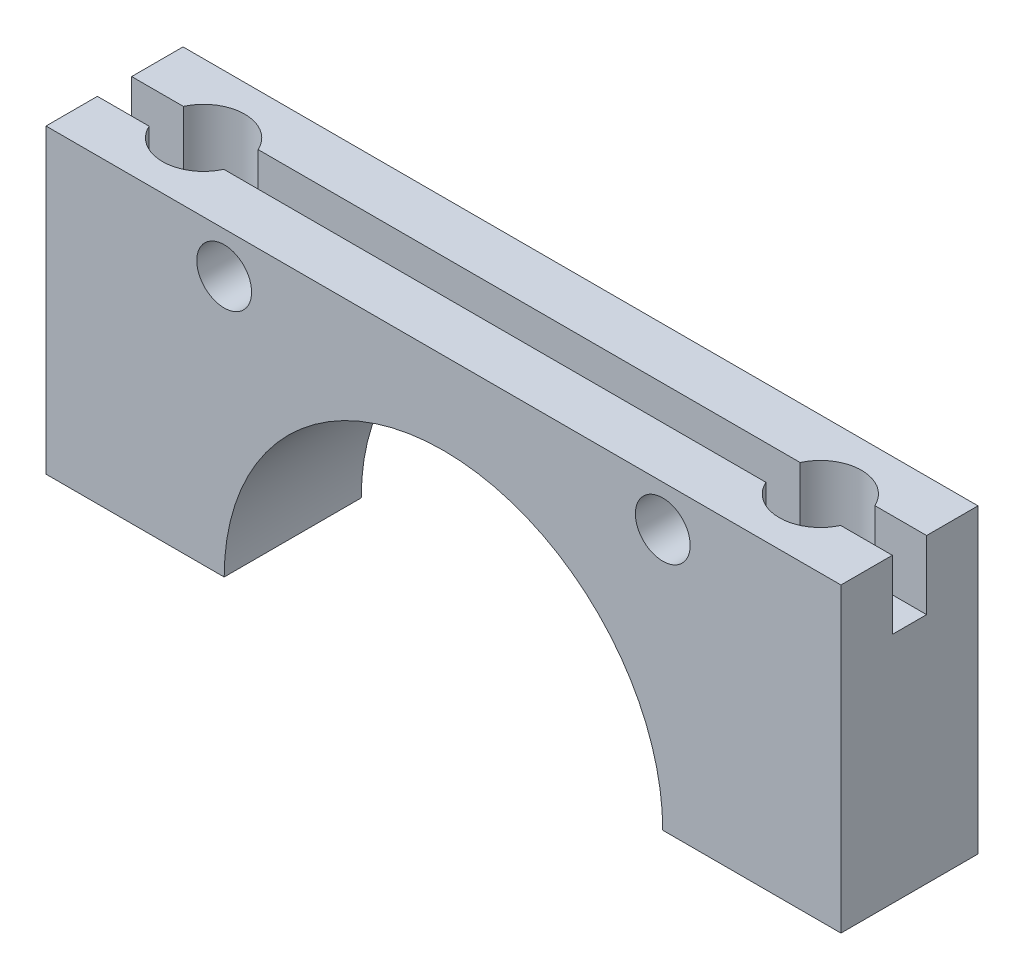
from build123d import *

# Parameters (mm, degrees)
EXTRUDE_1_DEPTH     = 10
SKETCH_2_R          = 1.6
CUT_EXTRUDE_1_DEPTH = 27
SKETCH_3_R          = 3
CUT_EXTRUDE_2_DEPTH = 15
SKETCH_4_W          = 58
SKETCH_4_H          = 2.5
CUT_EXTRUDE_4_DEPTH = 5
SKETCH_5_R          = 2
CUT_EXTRUDE_5_DEPTH = 5


with BuildPart() as part:
    # 草图1 → 凸台-拉伸1 (new body)
    with BuildSketch(Plane.XY):
        with BuildLine():
            Line((-69.33427814, 6.574466706), (-69.33427814, 28.574466706))
            Line((-69.33427814, 28.574466706), (-11.33427814, 28.574466706))
            Line((-11.33427814, 28.574466706), (-11.33427814, 6.574466706))
            Line((-11.33427814, 6.574466706), (-24.33427814, 6.574466706))
            ThreePointArc((-24.33427814, 6.574466706), (-40.33427814, 22.574466706), (-56.33427814, 6.574466706))
            Line((-56.33427814, 6.574466706), (-69.33427814, 6.574466706))
        make_face()
    extrude(amount=EXTRUDE_1_DEPTH)

    # 草图2 → 切除-拉伸1 (cut)
    with BuildSketch(Plane.XZ.offset(-6.574466706)):
        with Locations(Location((-62.83427814, 5, 0), (0, 0, 270))):
            Circle(SKETCH_2_R)
        with Locations(Location((-17.83427814, 5, 0), (0, 0, 270))):
            Circle(SKETCH_2_R)
    extrude(amount=-CUT_EXTRUDE_1_DEPTH, mode=Mode.SUBTRACT)

    # 草图3 → 切除-拉伸2 (cut)
    with BuildSketch(Plane(origin=(0, 28.574466706, 0), x_dir=(1, 0, 0), z_dir=(0, 1, 0))):
        with Locations(Location((-62.83427814, -5, 0), (0, 0, 270))):
            Circle(SKETCH_3_R)
        with Locations(Location((-17.83427814, -5, 0), (0, 0, 270))):
            Circle(SKETCH_3_R)
    extrude(amount=-CUT_EXTRUDE_2_DEPTH, mode=Mode.SUBTRACT)

    # 草图4 → 切除-拉伸4 (cut)
    with BuildSketch(Plane(origin=(0, 28.574466706, 0), x_dir=(1, 0, 0), z_dir=(0, 1, 0))):
        with Locations((-40.33427814, -5)):
            Rectangle(SKETCH_4_W, SKETCH_4_H)
    extrude(amount=-CUT_EXTRUDE_4_DEPTH, mode=Mode.SUBTRACT)

    # 草图5 → 切除-拉伸5 (cut)
    with BuildSketch(Plane.XY.offset(10)):
        with Locations((-56.33427814, 25.574466706)):
            Circle(SKETCH_5_R)
        with Locations((-24.33427814, 25.574466706)):
            Circle(SKETCH_5_R)
    extrude(amount=-CUT_EXTRUDE_5_DEPTH, mode=Mode.SUBTRACT)


solid = part.part
